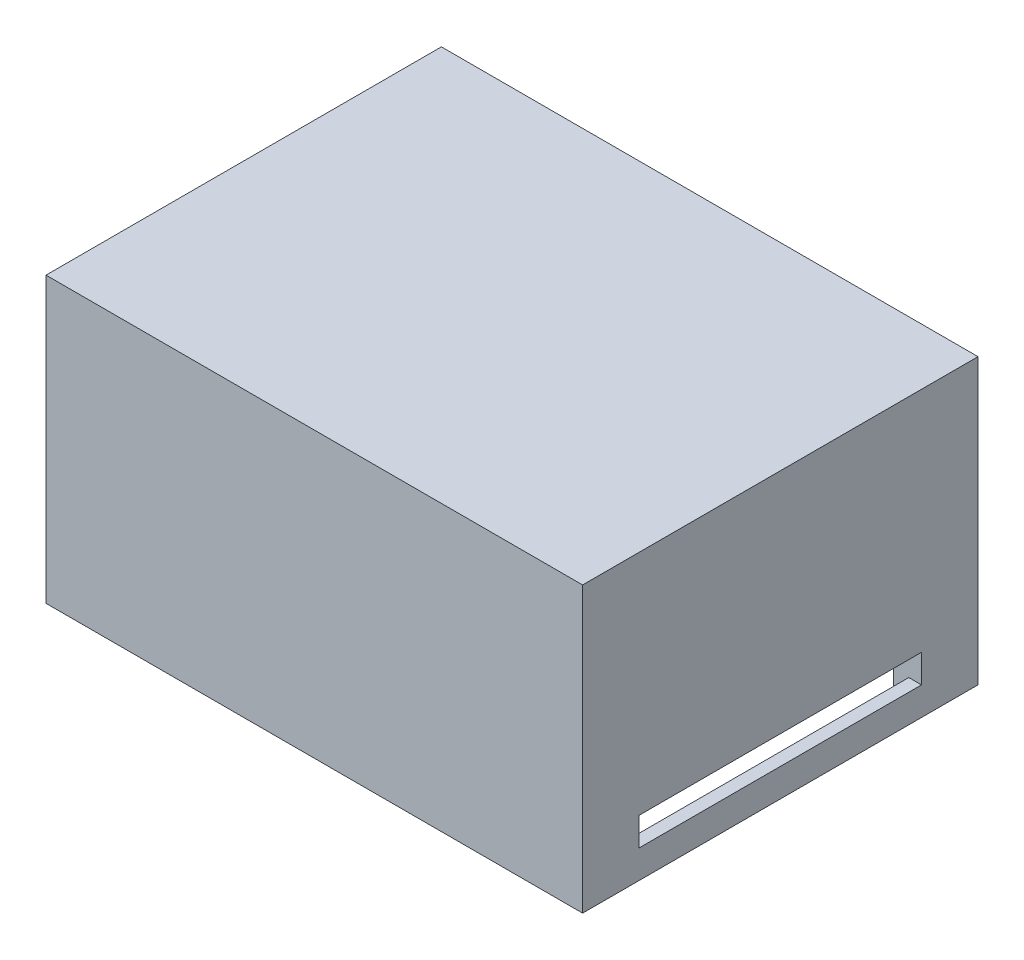
from build123d import *

# Parameters (mm, degrees)
SKETCH1_W           = 48.26
SKETCH1_H           = 25.5651
BOSS_EXTRUDE1_DEPTH = 17.78
SHELL1_T            = -2.54
SKETCH2_R           = 1.5875
BOSS_EXTRUDE2_DEPTH = 25.4
CUT_EXTRUDE1_DEPTH  = 12.7


with BuildPart() as part:
    # Sketch1 → Boss-Extrude1 (new, symmetric)
    with BuildSketch(Plane.XY):
        with Locations((24.13, -12.78255)):
            Rectangle(SKETCH1_W, SKETCH1_H)
    extrude(amount=BOSS_EXTRUDE1_DEPTH, both=True)

    # Shell1
    shell1_openings = [part.faces().sort_by_distance(p)[0] for p in [
        (24.13, -25.5651, 0),
    ]]
    offset(amount=SHELL1_T, openings=shell1_openings, kind=Kind.INTERSECTION)

    # Sketch2 → Boss-Extrude2 (add)
    with BuildSketch(Plane.XZ.offset(2.54)):
        with Locations(Location((10.16, 0, 0), (0, 0, 90))):
            Circle(SKETCH2_R)
    extrude(amount=BOSS_EXTRUDE2_DEPTH)

    # Sketch3 → Cut-Extrude1 (cut, symmetric)
    with BuildSketch(Plane.XY):
        Polygon((2.54, -25.5651), (2.54, -20.4851), (0, -20.4851), (0, -23.0251), (1.143, -23.0251), (0.508, -25.5651), align=None)
        Polygon((47.752, -25.5651), (47.117, -23.0251), (48.26, -23.0251), (48.26, -20.4851), (45.72, -20.4851), (45.72, -25.5651), align=None)
    extrude(amount=CUT_EXTRUDE1_DEPTH, both=True, mode=Mode.SUBTRACT)


solid = part.part
